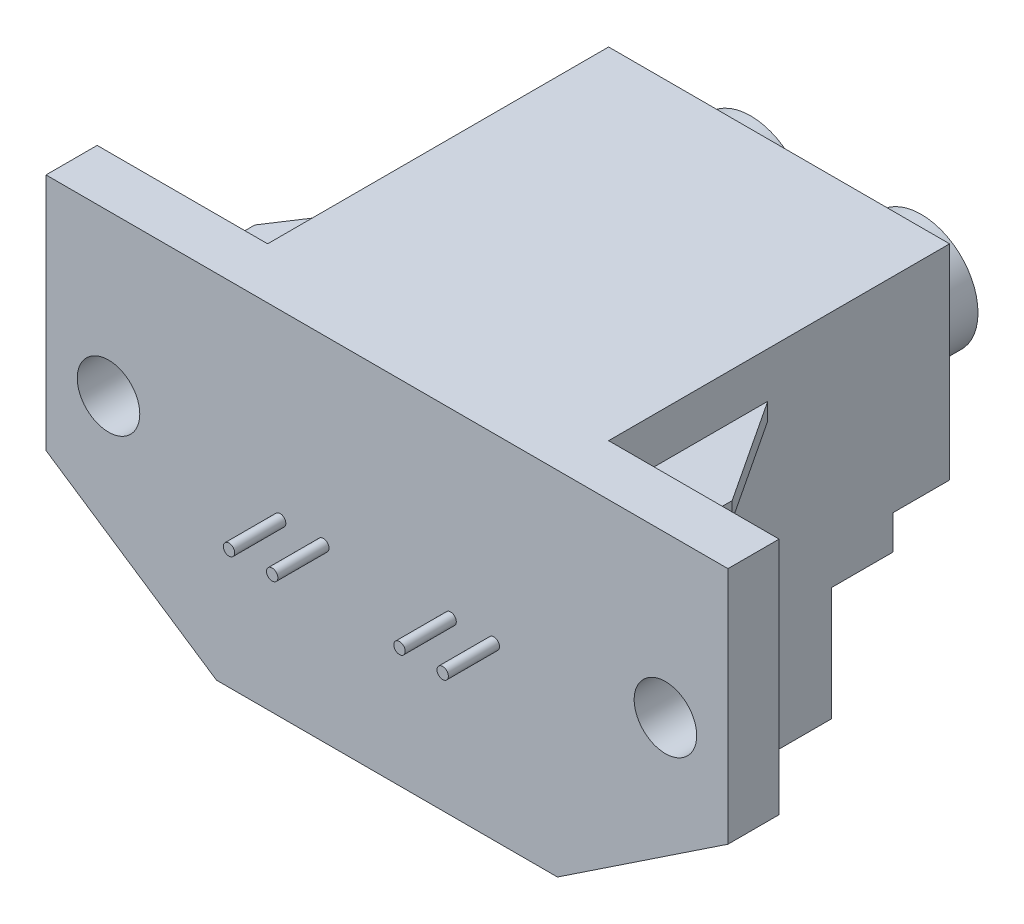
from build123d import *

# Parameters (mm, degrees)
SKETCH_1_R           = 2.75
EXTRUDE_1_DEPTH      = 4.5
EXTRUDE_2_DEPTH      = 15
EXTRUDE_2_DEPTH_BACK = 15
SKETCH_3_R           = 5
SKETCH_3_R_2         = 3.5
EXTRUDE_3_DEPTH      = 5
SKETCH_4_W           = 10
SKETCH_4_H           = 15
CUT_EXTRUDE_1_DEPTH  = 5
SKETCH_5_R           = 0.5
EXTRUDE_4_DEPTH      = 4.5
SKETCH_6_W           = 6
SKETCH_6_H           = 1.5
EXTRUDE_5_DEPTH      = 14
CUT_EXTRUDE_2_DEPTH  = 20


with BuildPart() as part:
    # Эскиз1 → Вытянуть1 (new body)
    with BuildSketch(Plane.XY):
        Polygon((-15, -16.9), (-30, -6.9), (-30, 14.1), (30, 14.1), (30, -6.9), (15, -16.9), align=None)
        with Locations((-24.5, 0)):
            Circle(SKETCH_1_R, mode=Mode.SUBTRACT)
        with Locations((24.5, 0)):
            Circle(SKETCH_1_R, mode=Mode.SUBTRACT)
    extrude(amount=EXTRUDE_1_DEPTH)

    # Эскиз2 → Вытянуть2 (add, two sides: drawn at the far end of the back side and taken through both)
    with BuildSketch(Plane(origin=(0, 0, 0), x_dir=(0, 0, -1), z_dir=(1, 0, 0)).offset(-EXTRUDE_2_DEPTH_BACK)):
        Polygon((0, -16.9), (19.60451018, -16.9), (19.60451018, -6.9), (25, -6.9), (25, -3.9), (30, -3.9), (30, 14.1), (0, 14.1), align=None)
    extrude(amount=EXTRUDE_2_DEPTH + EXTRUDE_2_DEPTH_BACK)

    # Эскиз3 → Вытянуть3 (add)
    # profile 1 of 2: a face of its own
    with BuildSketch(Plane(origin=(0, 0, -30), x_dir=(-1, 0, 0), z_dir=(0, 0, -1))):
        with Locations(Location((-7.5, 5.1, 0), (0, 0, 180))):
            Circle(SKETCH_3_R)
        with Locations((-7.5, 5.1)):
            Circle(SKETCH_3_R_2, mode=Mode.SUBTRACT)
    # profile 2 of 2: a face of its own
    with BuildSketch(Plane(origin=(0, 0, -30), x_dir=(-1, 0, 0), z_dir=(0, 0, -1))):
        with Locations(Location((7.5, 5.1, 0), (0, 0, 180))):
            Circle(SKETCH_3_R)
        with Locations((7.5, 5.1)):
            Circle(SKETCH_3_R_2, mode=Mode.SUBTRACT)
    extrude(amount=EXTRUDE_3_DEPTH)

    # Эскиз4 → Вырез-Вытянуть1 (cut)
    with BuildSketch(Plane.XZ.offset(16.9)):
        with Locations((7.5, -7.55225509)):
            Rectangle(SKETCH_4_W, SKETCH_4_H)
        with Locations((-7.5, -7.55225509)):
            Rectangle(SKETCH_4_W, SKETCH_4_H)
    extrude(amount=-CUT_EXTRUDE_1_DEPTH, mode=Mode.SUBTRACT)

    # Эскиз5 → Вытянуть4 (add)
    with BuildSketch(Plane.XY.offset(4.5)):
        with Locations(Location((-9.4, -1.9, 0), (0, 0, 180))):
            Circle(SKETCH_5_R)
        with Locations(Location((-5.6, -1.9, 0), (0, 0, 180))):
            Circle(SKETCH_5_R)
        with Locations(Location((5.6, -1.9, 0), (0, 0, 180))):
            Circle(SKETCH_5_R)
        with Locations(Location((9.4, -1.9, 0), (0, 0, 180))):
            Circle(SKETCH_5_R)
    extrude(amount=EXTRUDE_4_DEPTH)

    # Эскиз6 → Вытянуть5 (add)
    with BuildSketch(Plane(origin=(0, 0, 0), x_dir=(-1, 0, 0), z_dir=(0, 0, -1))):
        with Locations((-18, -8.15)):
            Rectangle(SKETCH_6_W, SKETCH_6_H)
        with Locations((-18, 9.35)):
            Rectangle(SKETCH_6_W, SKETCH_6_H)
        with Locations((18, 9.35)):
            Rectangle(SKETCH_6_W, SKETCH_6_H)
        with Locations((18, -8.15)):
            Rectangle(SKETCH_6_W, SKETCH_6_H)
    extrude(amount=EXTRUDE_5_DEPTH)

    # Эскиз7 → Вырез-Вытянуть2 (cut)
    with BuildSketch(Plane.XZ.offset(8.9)):
        Polygon((15, -14), (22.174858564, -3.085279584), (22.174858564, -17.29993251), align=None)
        Polygon((-22.174858564, -17.29993251), (-15, -14), (-22.174858564, -3.085279584), align=None)
    extrude(amount=-CUT_EXTRUDE_2_DEPTH, mode=Mode.SUBTRACT)


solid = part.part
